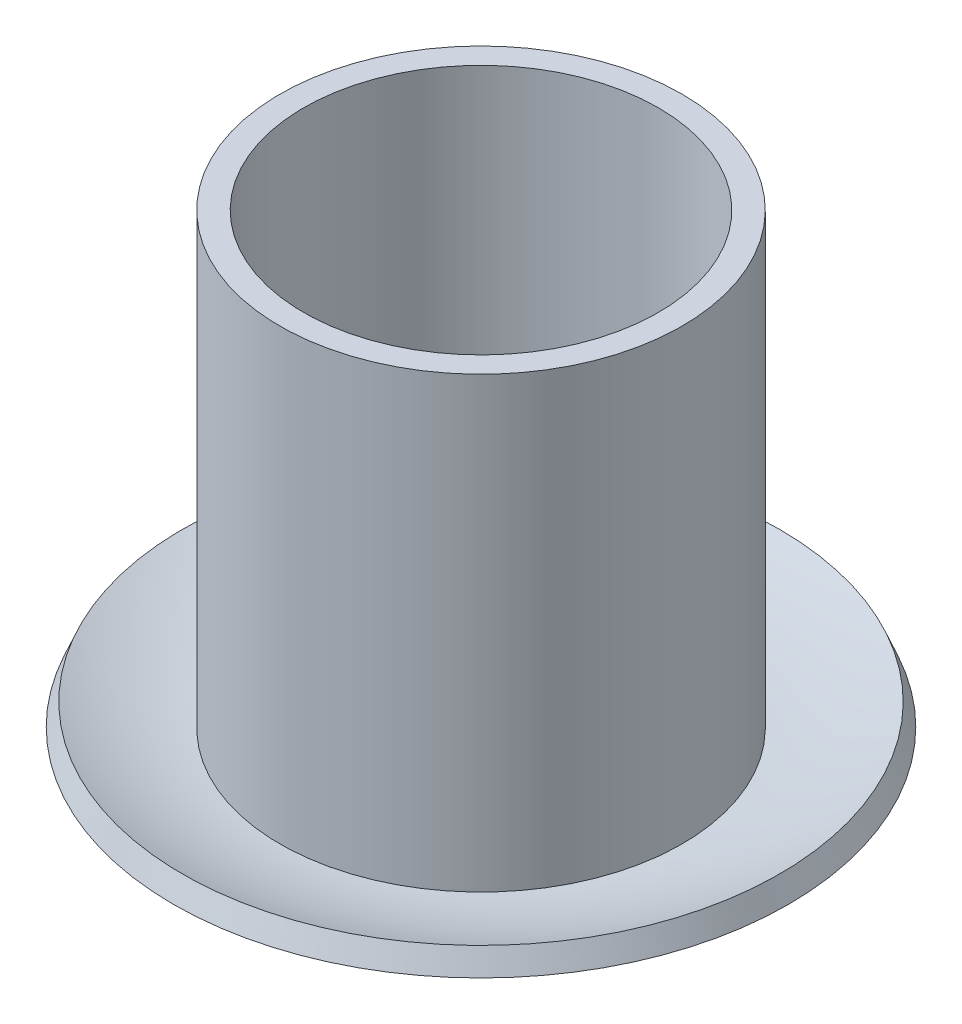
from build123d import *


with BuildPart() as part:
    # Sketch1 → Revolve1 (revolve)
    with BuildSketch(Plane.XY, mode=Mode.PRIVATE) as revolve1_sk:
        with BuildLine():
            Line((1.7, 4), (1.5, 4))
            Line((1.5, 4), (1.5, 0))
            ThreePointArc((1.5, 0), (2.060376165, 0.054170522), (2.6, 0.214675999))
            Line((2.6, 0.214675999), (2.524800168, 0.4))
            ThreePointArc((2.524800168, 0.4), (2.119929488, 0.271438363), (1.7, 0.207347904))
            Line((1.7, 0.207347904), (1.7, 4))
        make_face()
    revolve(revolve1_sk.sketch.rotate(Axis((0, 0, 0), (0, 1, 0)), 90), axis=Axis((0, 0, 0), (0, 1, 0)))


solid = part.part
